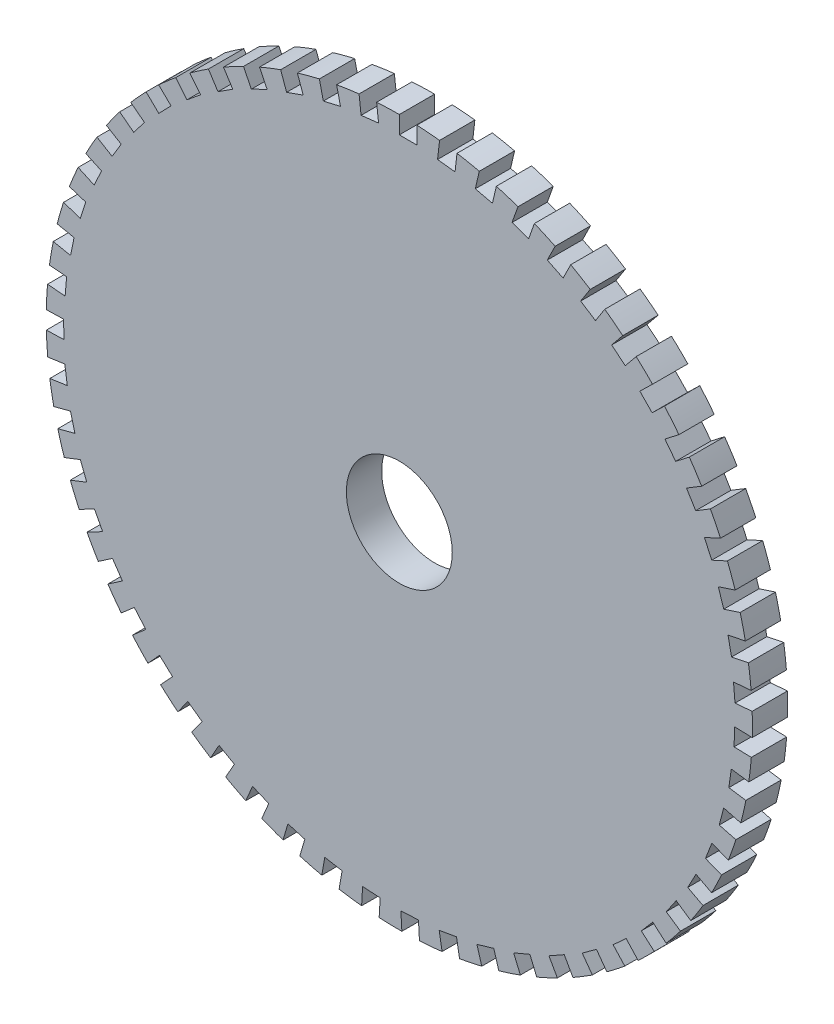
from build123d import *

# Parameters (mm, degrees)
SKETCH1_R           = 10
SKETCH1_R_2         = 1.5
BOSS_EXTRUDE1_DEPTH = 1
SKETCH2_W           = 0.498770059
SKETCH2_H           = 0.73052009
CUT_EXTRUDE1_DEPTH  = 1


with BuildPart() as part:
    # Sketch1 → Boss-Extrude1 (new body)
    with BuildSketch(Plane.XY):
        Circle(SKETCH1_R)
        Circle(SKETCH1_R_2, mode=Mode.SUBTRACT)
    extrude(amount=BOSS_EXTRUDE1_DEPTH)

    # Sketch2 → Cut-Extrude1 (cut)
    with BuildSketch(Plane.XY.offset(1)):
        Polygon((1.082918394, 9.438076486), (1.166191409, 10.163834852), (1.661710352, 10.10697935), (1.578437337, 9.381220984), align=None)
        with Locations((0.24938503, 9.865260045)):
            Rectangle(SKETCH2_W, SKETCH2_H)
        Polygon((2.151719291, 9.253113211), (2.317179729, 9.964648484), (2.80298771, 9.851678678), (2.637527271, 9.140143405), align=None)
        Polygon((3.192469236, 8.947521455), (3.437960068, 9.635557684), (3.907723837, 9.467946308), (3.662233004, 8.779910079), align=None)
        Polygon((4.191600462, 8.525285073), (4.51392134, 9.180852653), (4.961516807, 8.960784779), (4.639195929, 8.305217198), align=None)
        Polygon((5.136087766, 7.991908562), (5.531036744, 8.606461168), (5.950628818, 8.336805716), (5.55567984, 7.72225311), align=None)
        Polygon((6.013618311, 7.354345301), (6.476046626, 7.9198713), (6.862165282, 7.604143641), (6.399736968, 7.038617642), align=None)
        Polygon((6.812752145, 6.620906902), (7.336631336, 7.130033797), (7.684242928, 6.772349925), (7.160363737, 6.26322303), align=None)
        Polygon((7.523071336, 5.801154857), (8.101571836, 6.2472454), (8.406144715, 5.852268271), (7.827644215, 5.406177727), align=None)
        Polygon((8.135315787, 4.905775886), (8.760895958, 5.283014606), (9.01845955, 4.85589335), (8.39287938, 4.47865463), align=None)
        Polygon((8.641503956, 3.946442624), (9.306008403, 4.249911636), (9.513204973, 3.796214433), (8.848700526, 3.49274542), align=None)
        Polygon((9.035036905, 2.935661447), (9.729802796, 3.161404569), (9.883931221, 2.687046055), (9.189165329, 2.461302932), align=None)
        Polygon((9.31078433, 1.886609433), (10.026754331, 2.031683759), (10.12580531, 1.542847922), (9.409835309, 1.397773597), align=None)
        Polygon((9.465151443, 0.812962581), (10.192991789, 0.875476843), (10.235674041, 0.378536408), (9.507833695, 0.316022145), align=None)
        Polygon((9.496125832, -0.271282483), (10.22634801, -0.292143251), (10.212105107, -0.790709908), (9.481882929, -0.769849139), align=None)
        Polygon((9.403303698, -1.351990964), (10.126388146, -1.455954812), (10.055405766, -1.949648111), (9.332321318, -1.845684262), align=None)
        Polygon((9.18789512, -2.415074175), (9.894415327, -2.600785775), (9.767618833, -3.083169668), (9.061098626, -2.897458068), align=None)
        Polygon((8.852708278, -3.446673201), (9.533453672, -3.711711518), (9.352496051, -4.176497395), (8.671750657, -3.911459077), align=None)
        Polygon((8.402112844, -4.433339571), (9.048208869, -4.774249426), (8.815449181, -5.21537809), (8.169353156, -4.874468235), align=None)
        Polygon((7.841983021, -5.362210579), (8.445006825, -5.77454769), (8.163479448, -6.186268357), (7.560455644, -5.773931246), align=None)
        Polygon((7.179620956, -6.221176972), (7.731711203, -6.699565895), (7.405086277, -7.076511154), (6.85299603, -6.598122232), align=None)
        Polygon((6.423661553, -6.99904081), (6.917620901, -7.537245012), (6.550156481, -7.874500807), (6.056197132, -7.336296604), align=None)
        Polygon((5.583959897, -7.685661447), (6.013348832, -8.276664614), (5.609835378, -8.569834299), (5.180446443, -7.978831131), align=None)
        Polygon((4.671462784, -8.272087733), (5.030683564, -8.908185235), (4.596381493, -9.153446895), (4.237160712, -8.517349392), align=None)
        Polygon((3.69806601, -8.750674705), (3.982435643, -9.423574038), (3.523006745, -9.617730312), (3.238637112, -8.944830978), align=None)
        Polygon((2.67645929, -9.115183249), (2.882270583, -9.816112143), (2.403704216, -9.956631906), (2.197892923, -9.255703013), align=None)
        Polygon((1.61996083, -9.360861441), (1.744530717, -10.080682213), (1.253065727, -10.165733577), (1.12849584, -9.445912805), align=None)
        Polygon((0.542343703, -9.484506487), (0.584048226, -10.213835175), (0.08609161, -10.242309364), (0.044387087, -9.512980677), align=None)
        Polygon((-0.542343703, -9.484506487), (-0.584048226, -10.213835175), (-1.082004843, -10.185360985), (-1.04030032, -9.456032298), align=None)
        Polygon((-1.61996083, -9.360861441), (-1.744530717, -10.080682213), (-2.235995708, -9.995630849), (-2.11142582, -9.275810077), align=None)
        Polygon((-2.67645929, -9.115183249), (-2.882270583, -9.816112143), (-3.360836949, -9.675592379), (-3.155025657, -8.974663485), align=None)
        Polygon((-3.69806601, -8.750674705), (-3.982435643, -9.423574038), (-4.441864541, -9.229417765), (-4.157494908, -8.556518431), align=None)
        Polygon((-4.671462784, -8.272087733), (-5.030683564, -8.908185235), (-5.464985636, -8.662923575), (-5.105764856, -8.026826073), align=None)
        Polygon((-5.583959897, -7.685661447), (-6.013348832, -8.276664614), (-6.416862286, -7.983494929), (-5.98747335, -7.392491762), align=None)
        Polygon((-6.423661553, -6.99904081), (-6.917620901, -7.537245012), (-7.285085322, -7.199989217), (-6.791125973, -6.661785015), align=None)
        Polygon((-7.179620956, -6.221176972), (-7.731711203, -6.699565895), (-8.05833613, -6.322620635), (-7.506245883, -5.844231713), align=None)
        Polygon((-7.841983021, -5.362210579), (-8.445006825, -5.77454769), (-8.726534203, -5.362827024), (-8.123510398, -4.950489913), align=None)
        Polygon((-8.402112844, -4.433339571), (-9.048208869, -4.774249426), (-9.280968557, -4.333120761), (-8.634872533, -3.992210906), align=None)
        Polygon((-8.852708278, -3.446673201), (-9.533453672, -3.711711518), (-9.714411292, -3.246925642), (-9.033665898, -2.981887324), align=None)
        Polygon((-9.18789512, -2.415074175), (-9.894415327, -2.600785775), (-10.02121182, -2.118401882), (-9.314691613, -1.932690282), align=None)
        Polygon((-9.403303698, -1.351990964), (-10.126388146, -1.455954812), (-10.197370527, -0.962261514), (-9.474286078, -0.858297665), align=None)
        Polygon((-9.496125832, -0.271282483), (-10.22634801, -0.292143251), (-10.240590913, 0.206423405), (-9.510368735, 0.227284174), align=None)
        Polygon((-9.465151443, 0.812962581), (-10.192991789, 0.875476843), (-10.150309537, 1.372417279), (-9.422469191, 1.309903016), align=None)
        Polygon((-9.31078433, 1.886609433), (-10.026754331, 2.031683759), (-9.927703352, 2.520519595), (-9.211733352, 2.375445269), align=None)
        Polygon((-9.035036905, 2.935661447), (-9.729802796, 3.161404569), (-9.575674372, 3.635763083), (-8.88090848, 3.410019961), align=None)
        Polygon((-8.641503956, 3.946442624), (-9.306008403, 4.249911636), (-9.098811832, 4.70360884), (-8.434307386, 4.400139827), align=None)
        Polygon((-8.135315787, 4.905775886), (-8.760895958, 5.283014606), (-8.503332366, 5.710135862), (-7.877752195, 5.332897141), align=None)
        Polygon((-7.523071336, 5.801154857), (-8.101571836, 6.2472454), (-7.796998957, 6.64222253), (-7.218498458, 6.196131986), align=None)
        Polygon((-6.812752145, 6.620906902), (-7.336631336, 7.130033797), (-6.989019744, 7.48771767), (-6.465140553, 6.978590774), align=None)
        Polygon((-6.013618311, 7.354345301), (-6.476046626, 7.9198713), (-6.089927969, 8.235598959), (-5.627499655, 7.67007296), align=None)
        Polygon((-5.136087766, 7.991908562), (-5.531036744, 8.606461168), (-5.111444671, 8.87611662), (-4.716495692, 8.261564014), align=None)
        Polygon((-4.191600462, 8.525285073), (-4.51392134, 9.180852653), (-4.066325874, 9.400920528), (-3.744004995, 8.745352947), align=None)
        Polygon((-3.192469236, 8.947521455), (-3.437960068, 9.635557684), (-2.9681963, 9.803169059), (-2.722705467, 9.11513283), align=None)
        Polygon((-2.151719291, 9.253113211), (-2.317179729, 9.964648484), (-1.831371749, 10.07761829), (-1.66591131, 9.366083017), align=None)
        Polygon((-1.082918394, 9.438076486), (-1.166191409, 10.163834852), (-0.670672466, 10.220690354), (-0.587399451, 9.494931988), align=None)
    extrude(amount=-CUT_EXTRUDE1_DEPTH, mode=Mode.SUBTRACT)


solid = part.part
